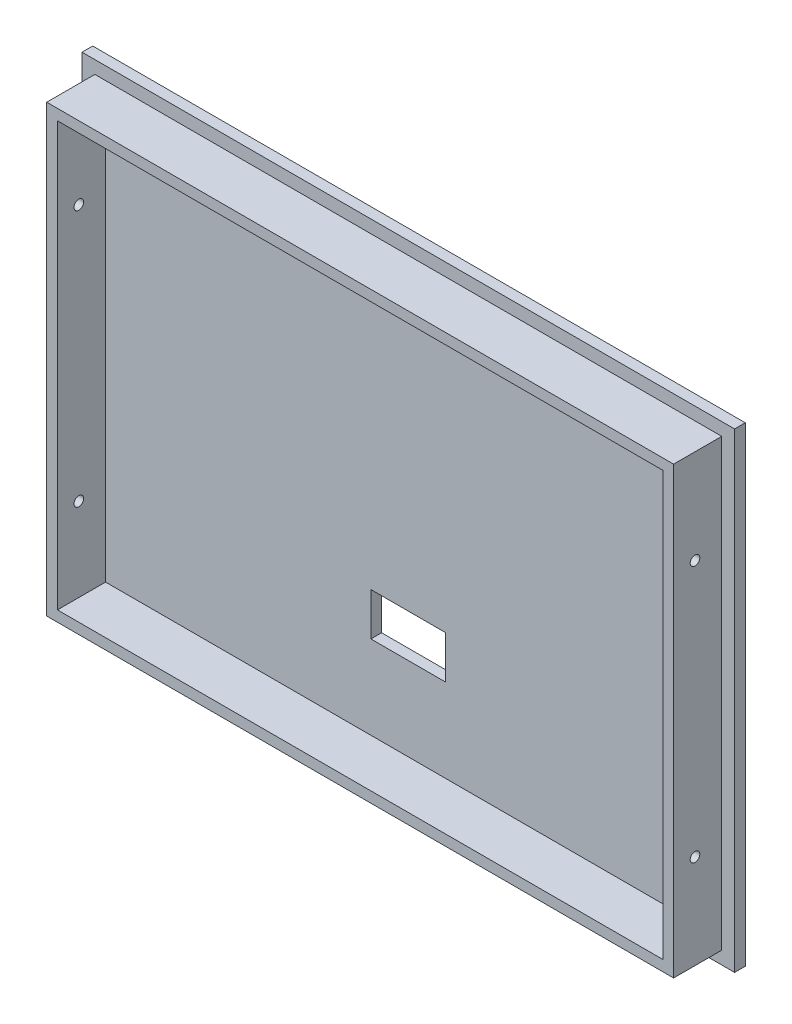
from build123d import *

# Parameters (mm, degrees)
BOSS_EXTRUDE1_START = -2
SKETCH1_W           = 122
SKETCH1_H           = 88
BOSS_EXTRUDE1_DEPTH = 2
BOSS_EXTRUDE2_START = -0.5
SKETCH2_W           = 117.2
SKETCH2_H           = 83.2
BOSS_EXTRUDE2_DEPTH = 9.5
SKETCH3_W           = 113.2
SKETCH3_H           = 79.2
BOSS_EXTRUDE3_DEPTH = 10
BOSS_EXTRUDE4_START = -3
SKETCH4_W           = 14
SKETCH4_H           = 8
BOSS_EXTRUDE4_DEPTH = 4
BOSS_EXTRUDE5_START = -65
SKETCH5_R           = 0.9
BOSS_EXTRUDE5_DEPTH = 130
BOSS_EXTRUDE6_START = -65
SKETCH6_R           = 0.9
BOSS_EXTRUDE6_DEPTH = 130


with BuildPart() as part:
    # Sketch1 → Boss-Extrude1 (new body)
    with BuildSketch(Plane.XY.offset(BOSS_EXTRUDE1_START)):
        with Locations((0, 44)):
            Rectangle(SKETCH1_W, SKETCH1_H)
    extrude(amount=BOSS_EXTRUDE1_DEPTH)

    # Sketch2 → Boss-Extrude2 (add)
    with BuildSketch(Plane.XY.offset(BOSS_EXTRUDE2_START)):
        with Locations((0, 44)):
            Rectangle(SKETCH2_W, SKETCH2_H)
    extrude(amount=BOSS_EXTRUDE2_DEPTH)


with BuildPart() as body_2:
    # Sketch3 → Boss-Extrude3 (new body)
    with BuildSketch(Plane.XY):
        with Locations((0, 44)):
            Rectangle(SKETCH3_W, SKETCH3_H)
    extrude(amount=BOSS_EXTRUDE3_DEPTH)


with BuildPart() as part_1:
    add(part.part)

    # Combine1: cut body 2
    add(body_2.part, mode=Mode.SUBTRACT)


with BuildPart() as body_2_2:
    # Sketch4 → Boss-Extrude4 (new body)
    with BuildSketch(Plane.XY.offset(BOSS_EXTRUDE4_START)):
        with Locations((0, 24)):
            Rectangle(SKETCH4_W, SKETCH4_H)
    extrude(amount=BOSS_EXTRUDE4_DEPTH)


with BuildPart() as part_2:
    add(part_1.part)

    # Combine2: cut body 2 2
    add(body_2_2.part, mode=Mode.SUBTRACT)


with BuildPart() as body_2_3:
    # Sketch5 → Boss-Extrude5 (new body)
    with BuildSketch(Plane(origin=(0, 0, 0), x_dir=(0, 0, -1), z_dir=(1, 0, 0)).offset(BOSS_EXTRUDE5_START)):
        with Locations((-5, 20)):
            Circle(SKETCH5_R)
    extrude(amount=BOSS_EXTRUDE5_DEPTH)


with BuildPart() as part_3:
    add(part_2.part)

    # Combine3: cut body 2 3
    add(body_2_3.part, mode=Mode.SUBTRACT)


with BuildPart() as body_2_4:
    # Sketch6 → Boss-Extrude6 (new body)
    with BuildSketch(Plane(origin=(0, 0, 0), x_dir=(0, 0, -1), z_dir=(1, 0, 0)).offset(BOSS_EXTRUDE6_START)):
        with Locations((-5, 68)):
            Circle(SKETCH6_R)
    extrude(amount=BOSS_EXTRUDE6_DEPTH)


with BuildPart() as part_4:
    add(part_3.part)

    # Combine4: cut body 2 4
    add(body_2_4.part, mode=Mode.SUBTRACT)


solid = part_4.part
